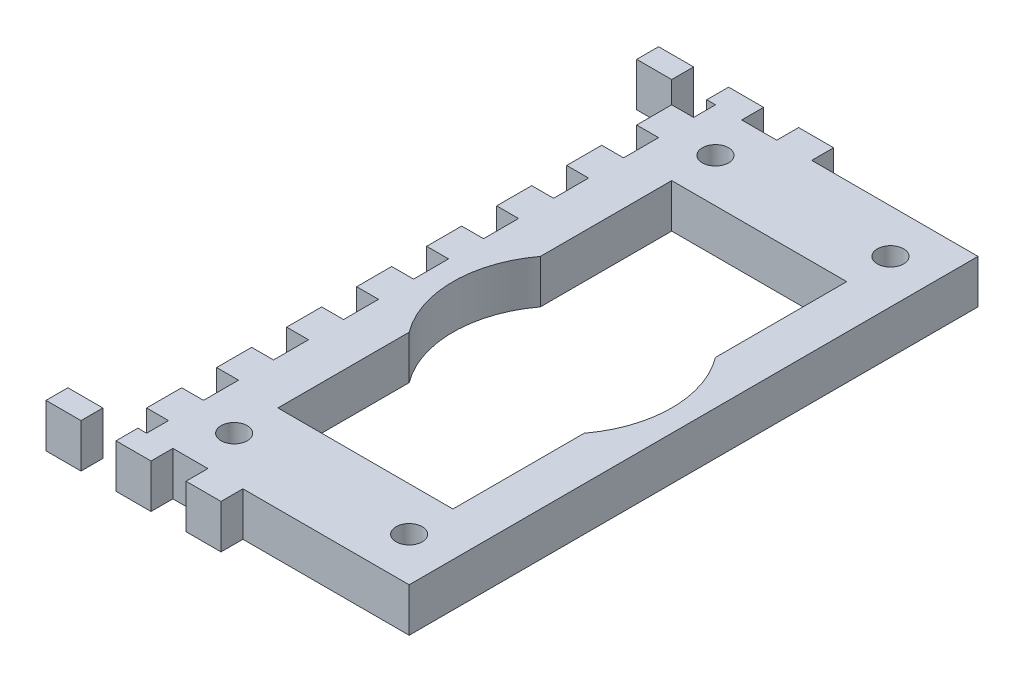
from build123d import *

# Parameters (mm, degrees)
SKETCH1_W           = 38.1
SKETCH1_H           = 82.55
SKETCH1_R           = 1.905
SKETCH1_W_2         = 25.4
SKETCH1_H_2         = 57.15
BOSS_EXTRUDE1_DEPTH = 6.35
SKETCH2_R           = 15.875
CUT_EXTRUDE1_DEPTH  = 46.900442536
SKETCH3_W           = 3.175
SKETCH3_H           = 5.08
SKETCH3_W_2         = 5.08
SKETCH3_H_2         = 3.175
BOSS_EXTRUDE2_DEPTH = 6.35


with BuildPart() as part:
    # Sketch1 → Boss-Extrude1 (new body)
    with BuildSketch(Plane(origin=(0, 0, 0), x_dir=(1, 0, 0), z_dir=(0, 1, 0))):
        Rectangle(SKETCH1_W, SKETCH1_H)
        with Locations(Location((-12.7, 34.925, 0), (0, 0, 270))):
            Circle(SKETCH1_R, mode=Mode.SUBTRACT)
        with Locations(Location((12.7, 34.925, 0), (0, 0, 270))):
            Circle(SKETCH1_R, mode=Mode.SUBTRACT)
        with Locations(Location((12.7, -34.925, 0), (0, 0, 270))):
            Circle(SKETCH1_R, mode=Mode.SUBTRACT)
        with Locations(Location((-12.7, -34.925, 0), (0, 0, 270))):
            Circle(SKETCH1_R, mode=Mode.SUBTRACT)
        Rectangle(SKETCH1_W_2, SKETCH1_H_2, mode=Mode.SUBTRACT)
    extrude(amount=BOSS_EXTRUDE1_DEPTH)

    # Sketch2 → Cut-Extrude1 (cut, through all)
    with BuildSketch(Plane(origin=(0, 0, 0), x_dir=(1, 0, 0), z_dir=(0, 1, 0))):
        Circle(SKETCH2_R)
    extrude(amount=CUT_EXTRUDE1_DEPTH, mode=Mode.SUBTRACT)

    # Sketch3 → Boss-Extrude2 (add)
    with BuildSketch(Plane(origin=(0, 6.35, 0), x_dir=(1, 0, 0), z_dir=(0, 1, 0))):
        with Locations((-20.6375, 35.56)):
            Rectangle(SKETCH3_W, SKETCH3_H)
        with Locations((-20.6375, 25.4)):
            Rectangle(SKETCH3_W, SKETCH3_H)
        with Locations((-20.6375, 15.24)):
            Rectangle(SKETCH3_W, SKETCH3_H)
        with Locations((-20.6375, 5.08)):
            Rectangle(SKETCH3_W, SKETCH3_H)
        with Locations((-20.6375, -5.08)):
            Rectangle(SKETCH3_W, SKETCH3_H)
        with Locations((-20.6375, -15.24)):
            Rectangle(SKETCH3_W, SKETCH3_H)
        with Locations((-20.6375, -25.4)):
            Rectangle(SKETCH3_W, SKETCH3_H)
        with Locations((-20.6375, -35.56)):
            Rectangle(SKETCH3_W, SKETCH3_H)
        with Locations((-7.62, 42.8625)):
            Rectangle(SKETCH3_W_2, SKETCH3_H_2)
        with Locations((-17.78, 42.8625)):
            Rectangle(SKETCH3_W_2, SKETCH3_H_2)
        with Locations((-27.94, 42.8625)):
            Rectangle(SKETCH3_W_2, SKETCH3_H_2)
        with Locations((-27.94, -42.8625)):
            Rectangle(SKETCH3_W_2, SKETCH3_H_2)
        with Locations((-17.78, -42.8625)):
            Rectangle(SKETCH3_W_2, SKETCH3_H_2)
        with Locations((-7.62, -42.8625)):
            Rectangle(SKETCH3_W_2, SKETCH3_H_2)
    extrude(amount=-BOSS_EXTRUDE2_DEPTH)


with BuildPart() as boss_extrude2_piece_1:
    # of the separate pieces the step leaves, piece 1, a body of its own (boss_extrude2_pieces)
    add(part.part.solids().sort_by_distance((-15.24, 0, 41.275))[0])


with BuildPart() as boss_extrude2_piece_2:
    # of the separate pieces the step leaves, piece 2, a body of its own (boss_extrude2_pieces)
    add(part.part.solids().sort_by_distance((-25.4, 6.35, -41.275))[0])


with BuildPart() as boss_extrude2_piece_3:
    # of the separate pieces the step leaves, piece 3, a body of its own (boss_extrude2_pieces)
    add(part.part.solids().sort_by_distance((-25.4, 6.35, 41.275))[0])


solid = Compound([boss_extrude2_piece_1.part, boss_extrude2_piece_2.part, boss_extrude2_piece_3.part])
